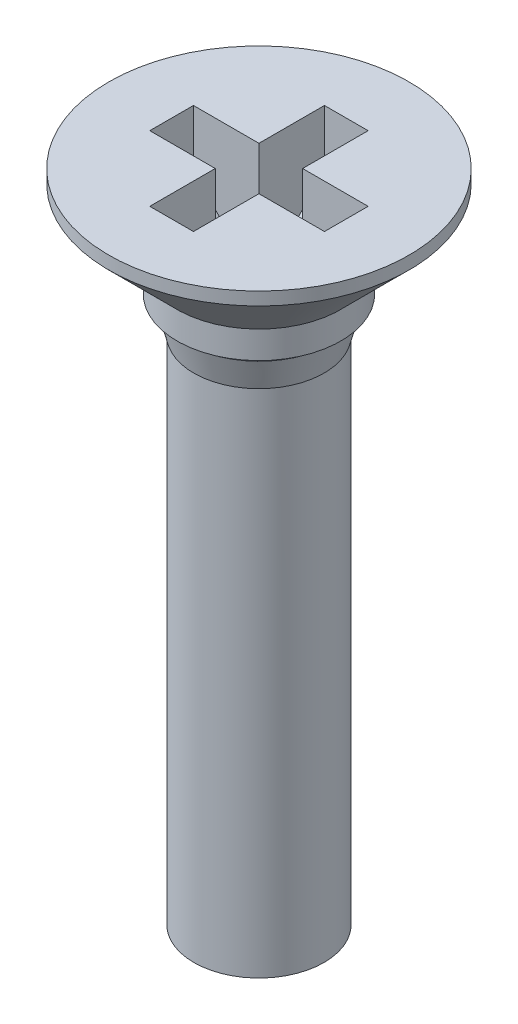
from build123d import *

# Parameters (mm, degrees)
KREUZSCHLITZ1_H_DEPTH      = 0.4
KREUZSCHLITZ1_H_DEPTH_BACK = 0.4
KREUZSCHLITZ2_H_DEPTH      = 0.4
KREUZSCHLITZ2_H_DEPTH_BACK = 0.4
BOSS_EXTRUDE1_START        = 4
SKETCH1_R                  = 1.1935
BOSS_EXTRUDE1_DEPTH        = 4


with BuildPart() as part:
    # Skizze1 → Basis-Rotation (revolve)
    with BuildSketch(Plane.XY, mode=Mode.PRIVATE) as basis_rotation_sk:
        Polygon((0, 0), (2.75, 0), (2.75, -0.2375), (1.5, -1.4875), (1.5, -1.9875), (1.3375, -1.9875), (1.3375, -2.112584684), (1.1935, -2.65), (1.1935, -8), (0, -8), align=None)
    revolve(basis_rotation_sk.sketch.rotate(Axis((0, 0, 0), (0, -1, 0)), 180), axis=Axis((0, 0, 0), (0, -1, 0)))

    # Skizze2 → Kreuzschlitz1 H (cut, two sides: drawn at the far end of the back side and taken through both)
    with BuildSketch(Plane.XY.offset(-KREUZSCHLITZ1_H_DEPTH_BACK)):
        Polygon((-0.55, -2.1), (0.55, -2.1), (1.6, -1.05), (1.6, 0), (-1.6, 0), (-1.6, -1.05), align=None)
    extrude(amount=KREUZSCHLITZ1_H_DEPTH + KREUZSCHLITZ1_H_DEPTH_BACK, mode=Mode.SUBTRACT)

    # Skizze3 → Kreuzschlitz2 H (cut, two sides: drawn at the far end of the back side and taken through both)
    with BuildSketch(Plane(origin=(0, 0, 0), x_dir=(0, 0, -1), z_dir=(1, 0, 0)).offset(-KREUZSCHLITZ2_H_DEPTH_BACK)):
        Polygon((-0.55, -2.1), (0.55, -2.1), (1.6, -1.05), (1.6, 0), (-1.6, 0), (-1.6, -1.05), align=None)
    extrude(amount=KREUZSCHLITZ2_H_DEPTH + KREUZSCHLITZ2_H_DEPTH_BACK, mode=Mode.SUBTRACT)

    # Sketch1 → Boss-Extrude1 (add)
    with BuildSketch(Plane.XZ.offset(8).offset(BOSS_EXTRUDE1_START)):
        with Locations(Location((0, 0, 0), (0, 0, 180))):
            Circle(SKETCH1_R)
    extrude(amount=-BOSS_EXTRUDE1_DEPTH)


solid = part.part
